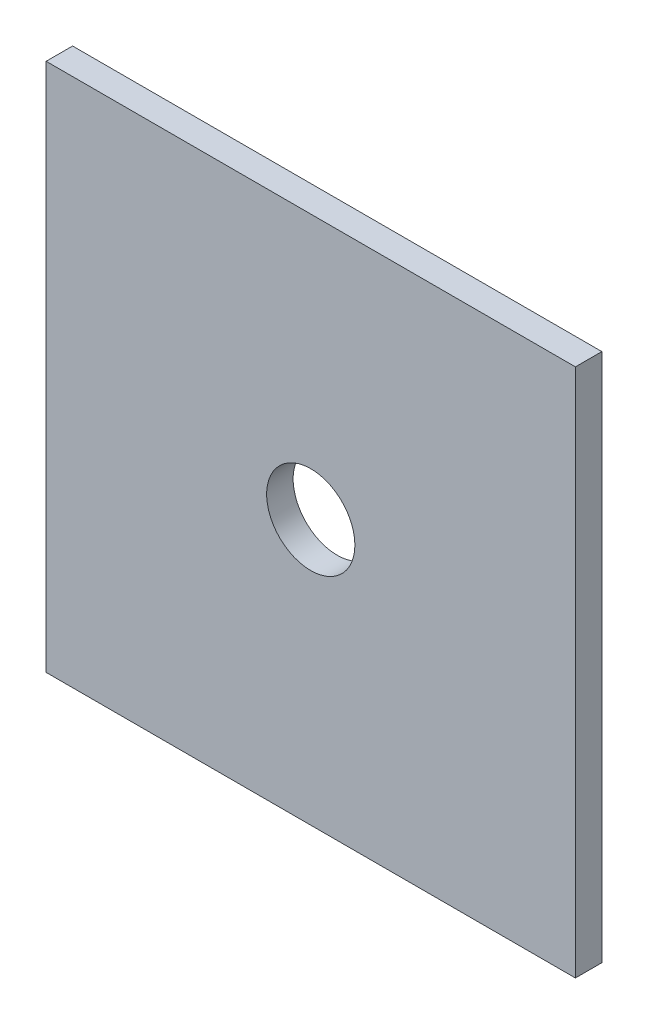
from build123d import *

# Parameters (mm, degrees)
SKETCH_1_W      = 300
SKETCH_1_H      = 300
SKETCH_1_R      = 25
EXTRUDE_1_DEPTH = 15


with BuildPart() as part:
    # ｽｹｯﾁ1 → ﾎﾞｽ - 押し出し1 (new body)
    with BuildSketch(Plane.XY):
        Rectangle(SKETCH_1_W, SKETCH_1_H)
        Circle(SKETCH_1_R, mode=Mode.SUBTRACT)
    extrude(amount=EXTRUDE_1_DEPTH)


solid = part.part
